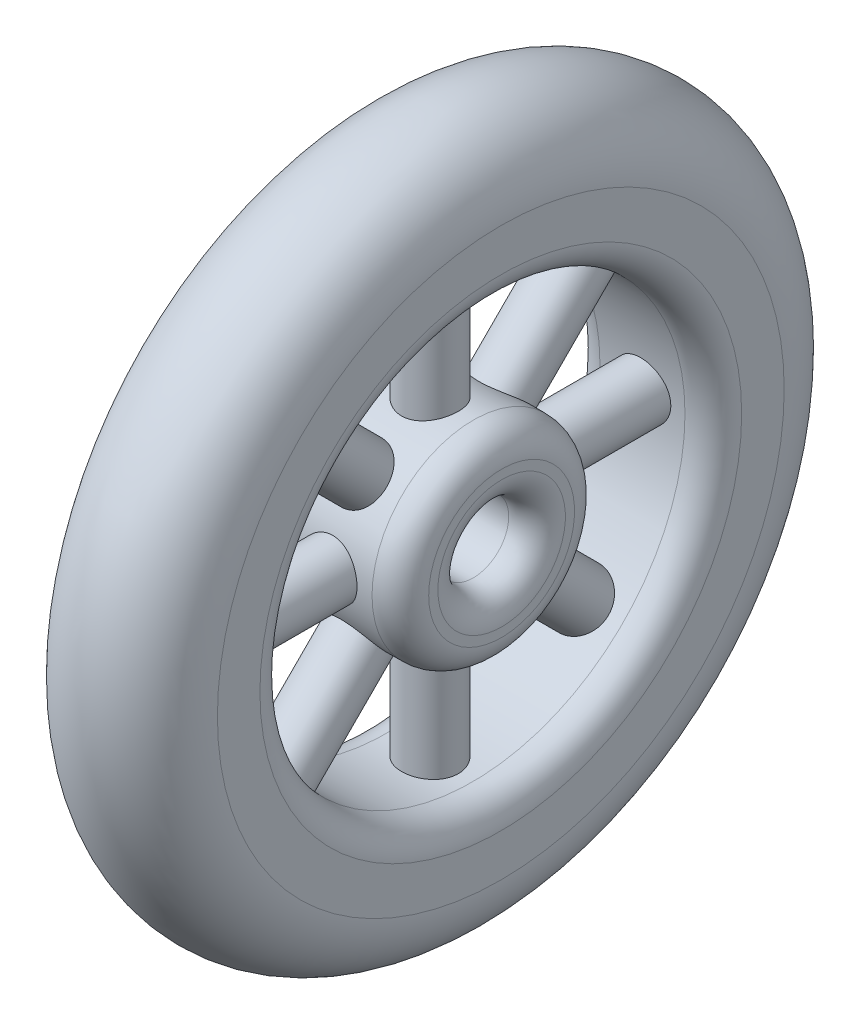
from build123d import *

# Parameters (mm, degrees)
SWEEP1_PROFILE_R  = 1.27
CIRPATTERN1_COUNT = 8
SCALE_2_SCALE     = 1.15


with BuildPart() as part:
    # Sketch3 → Revolve1 (revolve)
    with BuildSketch(Plane.XY, mode=Mode.PRIVATE) as revolve1_sk:
        with BuildLine():
            Line((-1.942226168, 1.5875), (1.942226168, 1.5875))
            ThreePointArc((1.942226168, 1.5875), (2.84025178, 1.959474388), (3.212226168, 2.8575))
            Line((3.212226168, 2.8575), (3.212226168, 3.268158252))
            ThreePointArc((3.212226168, 3.268158252), (2.84025178, 4.166183864), (1.942226168, 4.538158252))
            Line((1.942226168, 4.538158252), (-1.942226168, 4.538158252))
            ThreePointArc((-1.942226168, 4.538158252), (-2.84025178, 4.166183864), (-3.212226168, 3.268158252))
            Line((-3.212226168, 3.268158252), (-3.212226168, 2.8575))
            ThreePointArc((-3.212226168, 2.8575), (-2.84025178, 1.959474388), (-1.942226168, 1.5875))
        make_face()
        with BuildLine():
            Line((-3.175, 12.7), (-3.175, 10.795))
            ThreePointArc((-3.175, 10.795), (-2.803025612, 9.896974388), (-1.905, 9.525))
            Line((-1.905, 9.525), (1.905, 9.525))
            ThreePointArc((1.905, 9.525), (2.803025612, 9.896974388), (3.175, 10.795))
            Line((3.175, 10.795), (3.175, 12.7))
            ThreePointArc((3.175, 12.7), (0, 15.875), (-3.175, 12.7))
        make_face()
    revolve(revolve1_sk.sketch.rotate(Axis((-11.977214198, 0, 0), (1, 0, 0)), 90), axis=Axis((-11.977214198, 0, 0), (1, 0, 0)))

    # Sweep1: sweep along a path in Sketch5
    with BuildLine(Plane(origin=(0, 0, 0), x_dir=(0, 0, -1), z_dir=(1, 0, 0))) as sweep1_path:
        Line((0, 3.062829126), (0, 12.7))
    # Sweep1 profile (on start of the path) → Sweep1 (sweep)
    with BuildSketch(Plane.ZX.offset(3.062829126)):
        Circle(SWEEP1_PROFILE_R)
    sweep1 = sweep(path=sweep1_path.line)

    # CirPattern1: Sweep1 ×8 about axis
    cirpattern1_axis = Axis((-11.977214198, 0, 0), (1, 0, 0))
    for i in range(1, CIRPATTERN1_COUNT):
        add(sweep1.rotate(cirpattern1_axis, i * 360 / CIRPATTERN1_COUNT))


with BuildPart() as part_1:
    # Scale 2: scaled about (2.0691e-05, -5.4388e-05, -1.1572e-05)
    add(part.part.scale(SCALE_2_SCALE).moved(Location((-3.104e-06, 8.158e-06, 1.736e-06))))


solid = part_1.part
